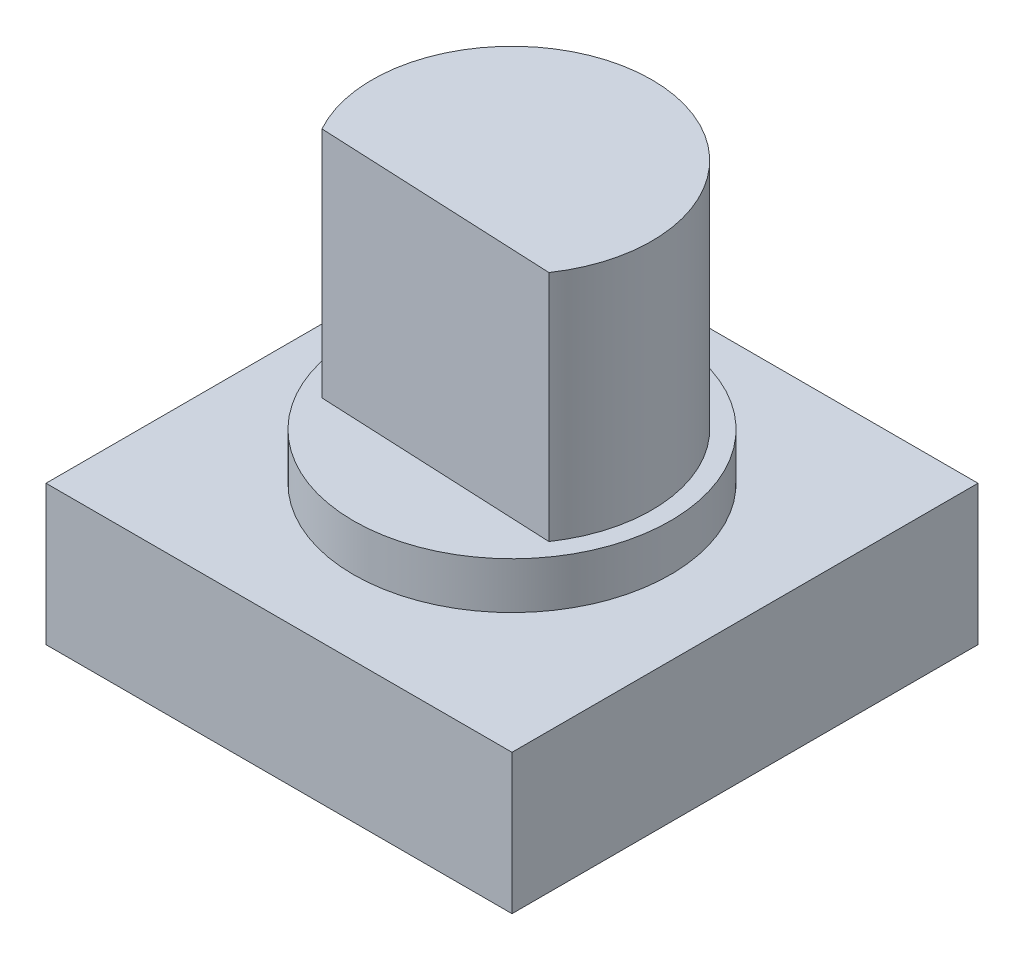
from build123d import *

# Parameters (mm, degrees)
SKETCH_1_W      = 10
SKETCH_1_H      = 10
EXTRUDE_1_DEPTH = 3
SKETCH_2_R      = 3.4
EXTRUDE_2_DEPTH = 1
EXTRUDE_3_DEPTH = 5


with BuildPart() as part:
    # 草图1 → 凸台-拉伸1 (new body)
    with BuildSketch(Plane(origin=(0, 0, 0), x_dir=(1, 0, 0), z_dir=(0, 1, 0))):
        with Locations((-0.373134328, -2.350746269)):
            Rectangle(SKETCH_1_W, SKETCH_1_H)
    extrude(amount=EXTRUDE_1_DEPTH)

    # 草图2 → 凸台-拉伸2 (add)
    with BuildSketch(Plane(origin=(0, 3, 0), x_dir=(1, 0, 0), z_dir=(0, 1, 0))):
        with Locations(Location((-0.373134328, -2.350746269, 0), (0, 0, 270))):
            Circle(SKETCH_2_R)
    extrude(amount=EXTRUDE_2_DEPTH)

    # 草图3 → 凸台-拉伸3 (add)
    with BuildSketch(Plane(origin=(0, 4, 0), x_dir=(1, 0, 0), z_dir=(0, 1, 0))):
        with BuildLine():
            Line((-2.997411901, -3.804419967), (2.106902355, -4.038768203))
            ThreePointArc((2.106902355, -4.038768203), (-0.235543876, 0.646096882), (-2.997411901, -3.804419967))
        make_face()
    extrude(amount=EXTRUDE_3_DEPTH)


solid = part.part
